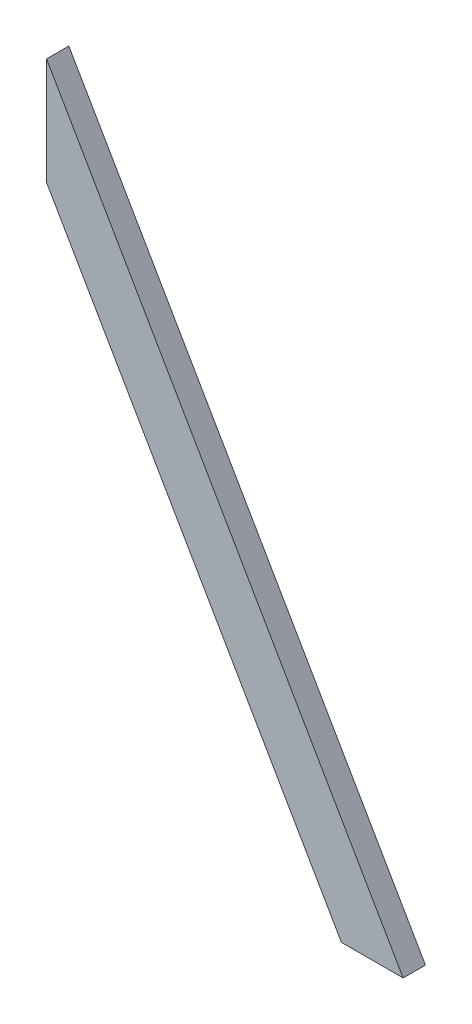
from build123d import *

# Parameters (mm, degrees)
BOSS_EXTRU_1_DEPTH = 25


with BuildPart() as part:
    # Esquisse1 → Boss.-Extru.1 (new body)
    with BuildSketch(Plane.XY):
        Polygon((0, 0), (-330.717967697, 572.820323028), (-330.717967697, 692.820323028), (69.282032303, 0), align=None)
    extrude(amount=BOSS_EXTRU_1_DEPTH)


solid = part.part
